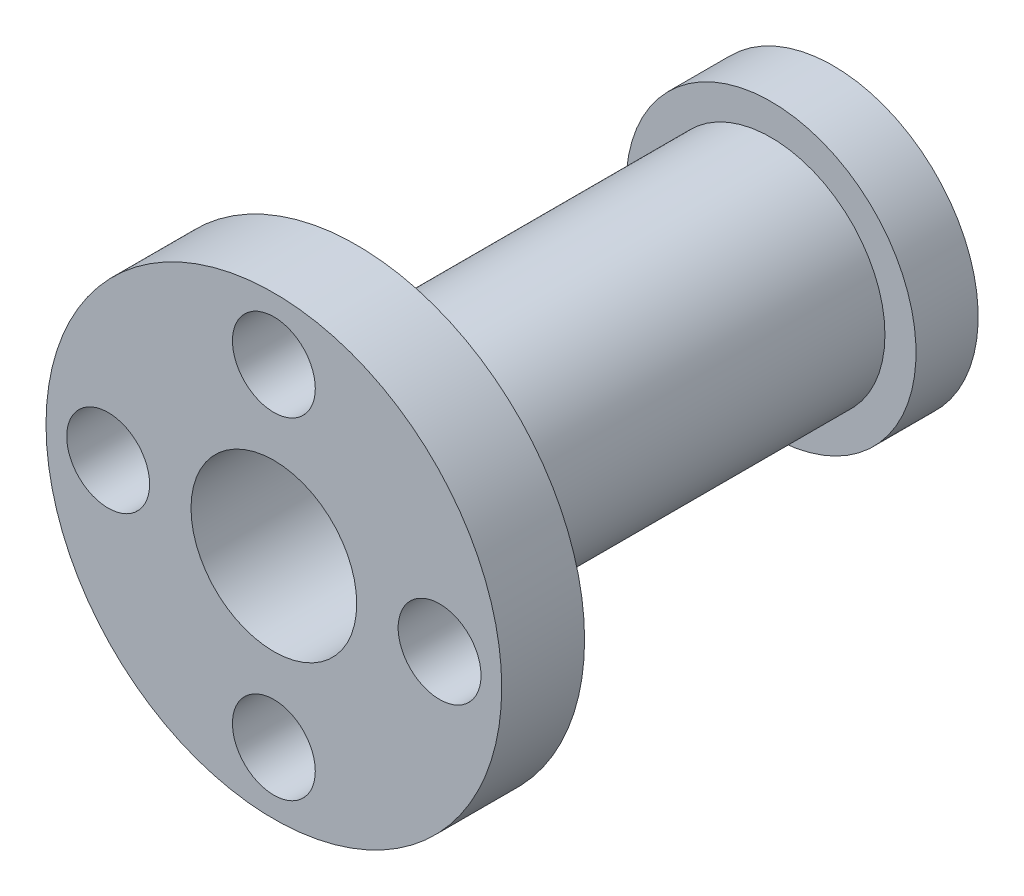
from build123d import *
from build123d.topology import SkipClean

# Parameters (mm, degrees)
SKETCH_1_R      = 11
SKETCH_1_R_2    = 2
SKETCH_1_R_3    = 4
EXTRUDE_1_DEPTH = 4
EXTRUDE_START   = 20
SKETCH_2_R      = 5.5
SKETCH_2_R_2    = 4
EXTRUDE_2_DEPTH = 20
EXTRUDE_START_2 = 3
SKETCH_3_R      = 7
SKETCH_3_R_2    = 4
EXTRUDE_3_DEPTH = 3


with BuildPart() as part:
    # 草图1 → 凸台-拉伸1 (new body)
    with BuildSketch(Plane.XY):
        Circle(SKETCH_1_R)
        with Locations((0, 8)):
            Circle(SKETCH_1_R_2, mode=Mode.SUBTRACT)
        with Locations((8, 0)):
            Circle(SKETCH_1_R_2, mode=Mode.SUBTRACT)
        with Locations((0, -8)):
            Circle(SKETCH_1_R_2, mode=Mode.SUBTRACT)
        with Locations((-8, 0)):
            Circle(SKETCH_1_R_2, mode=Mode.SUBTRACT)
        Circle(SKETCH_1_R_3, mode=Mode.SUBTRACT)
    extrude(amount=EXTRUDE_1_DEPTH)

    # 草图2 → 凸台-拉伸2 (add)
    with SkipClean():  # the faces are left unmerged after this step: merging them gives an invalid solid
        with BuildSketch(Plane(origin=(0, 0, 0), x_dir=(-1, 0, 0), z_dir=(0, 0, -1)).offset(EXTRUDE_START)):
            with Locations(Location((0, 0, 0), (0, 0, 180))):
                Circle(SKETCH_2_R)
            Circle(SKETCH_2_R_2, mode=Mode.SUBTRACT)
        extrude(amount=-EXTRUDE_2_DEPTH)

    # 草图3 → 凸台-拉伸3 (add)
    with SkipClean():  # the faces are left unmerged after this step: merging them gives an invalid solid
        with BuildSketch(Plane(origin=(0, 0, -20), x_dir=(-1, 0, 0), z_dir=(0, 0, -1)).offset(EXTRUDE_START_2)):
            Circle(SKETCH_3_R)
            Circle(SKETCH_3_R_2, mode=Mode.SUBTRACT)
        extrude(amount=-EXTRUDE_3_DEPTH)


solid = part.part
